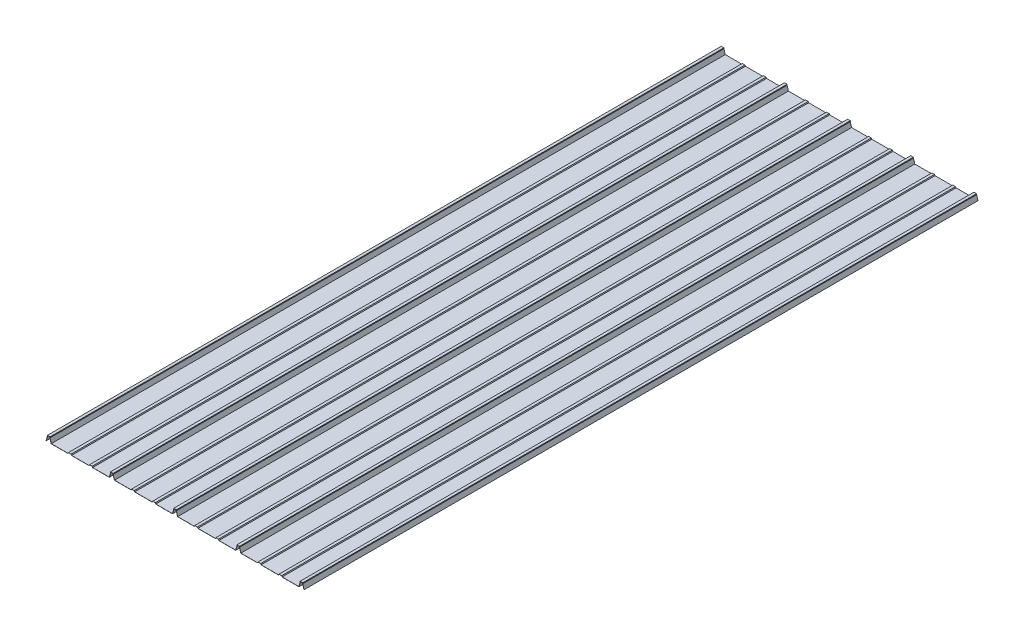
from build123d import *

# Parameters (mm, degrees)
SKETCH1_W           = 4.7625
SKETCH1_H           = 0.508
SKETCH1_W_2         = 31.504412895
BOSS_EXTRUDE1_DEPTH = 2438.4
LPATTERN1_COUNT     = 4
LPATTERN1_PITCH     = 228.6


with BuildPart() as part:
    # Sketch1 → Boss-Extrude1 (new body)
    with BuildSketch(Plane.XY):
        Polygon((4.7625, 15.875), (5.2705, 15.875), (5.2705, 18.542), (9.525, 18.542), (9.525, 19.05), (4.7625, 19.05), align=None)
        with BuildLine():
            ThreePointArc((5.249075753, 15.729027274), (5.265115401, 15.801231722), (5.2705, 15.875))
            Line((5.2705, 15.875), (4.7625, 15.875))
            Line((4.7625, 15.875), (0, 0))
            Line((0, 0), (-0.1524, -0.508))
            Line((-0.1524, -0.508), (0.377967571, -0.508))
            Line((0.377967571, -0.508), (0.486575753, -0.145972726))
            Line((0.486575753, -0.145972726), (5.249075753, 15.729027274))
        make_face()
        Polygon((9.525, 19.05), (9.525, 18.542), (13.7795, 18.542), (13.7795, 15.875), (14.2875, 15.875), (14.2875, 19.05), align=None)
        Polygon((14.2875, 15.875), (13.7795, 15.875), (13.800924247, 15.729027274), (18.519632429, 0), (19.05, 0), align=None)
        Polygon((79.129412895, 0), (19.05, 0), (18.519632429, 0), (18.563424247, -0.145972726), (18.672032429, -0.508), (79.129412895, -0.508), align=None)
        Polygon((79.422706832, 0), (79.129412895, 0), (79.129412895, -0.508), align=None)
        Polygon((80.9625, 3.175), (79.129412895, 0), (79.422706832, 0), (80.9625, 2.667), align=None)
        with Locations((83.34375, 2.921)):
            Rectangle(SKETCH1_W, SKETCH1_H)
        Polygon((92.320587105, -0.508), (92.320587105, 0), (92.027293168, 0), align=None)
        Polygon((92.320587105, 0), (90.4875, 3.175), (90.4875, 2.667), (92.027293168, 0), align=None)
        with Locations((88.10625, 2.921)):
            Rectangle(SKETCH1_W, SKETCH1_H)
        with Locations((108.072793553, -0.254)):
            Rectangle(SKETCH1_W_2, SKETCH1_H)
        with Locations((139.577206448, -0.254)):
            Rectangle(SKETCH1_W_2, SKETCH1_H)
        Polygon((155.622706832, 0), (155.329412895, 0), (155.329412895, -0.508), align=None)
        Polygon((157.1625, 3.175), (155.329412895, 0), (155.622706832, 0), (157.1625, 2.667), align=None)
        with Locations((159.54375, 2.921)):
            Rectangle(SKETCH1_W, SKETCH1_H)
        with Locations((164.30625, 2.921)):
            Rectangle(SKETCH1_W, SKETCH1_H)
        Polygon((168.520587105, 0), (166.6875, 3.175), (166.6875, 2.667), (168.227293168, 0), align=None)
        Polygon((168.520587105, -0.508), (168.520587105, 0), (168.227293168, 0), align=None)
        Polygon((228.6, 0), (168.520587105, 0), (168.520587105, -0.508), (228.977967571, -0.508), (229.086575753, -0.145972726), (229.130367571, 0), align=None)
        Polygon((233.3625, 15.875), (228.6, 0), (229.130367571, 0), (233.849075753, 15.729027274), (233.8705, 15.875), align=None)
        Polygon((233.3625, 19.05), (233.3625, 15.875), (233.8705, 15.875), (233.8705, 18.542), (238.125, 18.542), (238.125, 19.05), align=None)
        Polygon((242.8875, 19.05), (238.125, 19.05), (238.125, 18.542), (242.3795, 18.542), (242.3795, 15.875), (242.8875, 15.875), align=None)
        Polygon((247.163424247, -0.145972726), (247.272032429, -0.508), (247.8024, -0.508), (247.65, 0), (242.8875, 15.875), (242.3795, 15.875), (242.400924247, 15.729027274), align=None)
    boss_extrude1 = extrude(amount=BOSS_EXTRUDE1_DEPTH)

    # LPattern1: Boss-Extrude1 ×4
    with Locations(*[(i * LPATTERN1_PITCH, 0, 0) for i in range(1, LPATTERN1_COUNT)]):
        add(boss_extrude1)


solid = part.part
